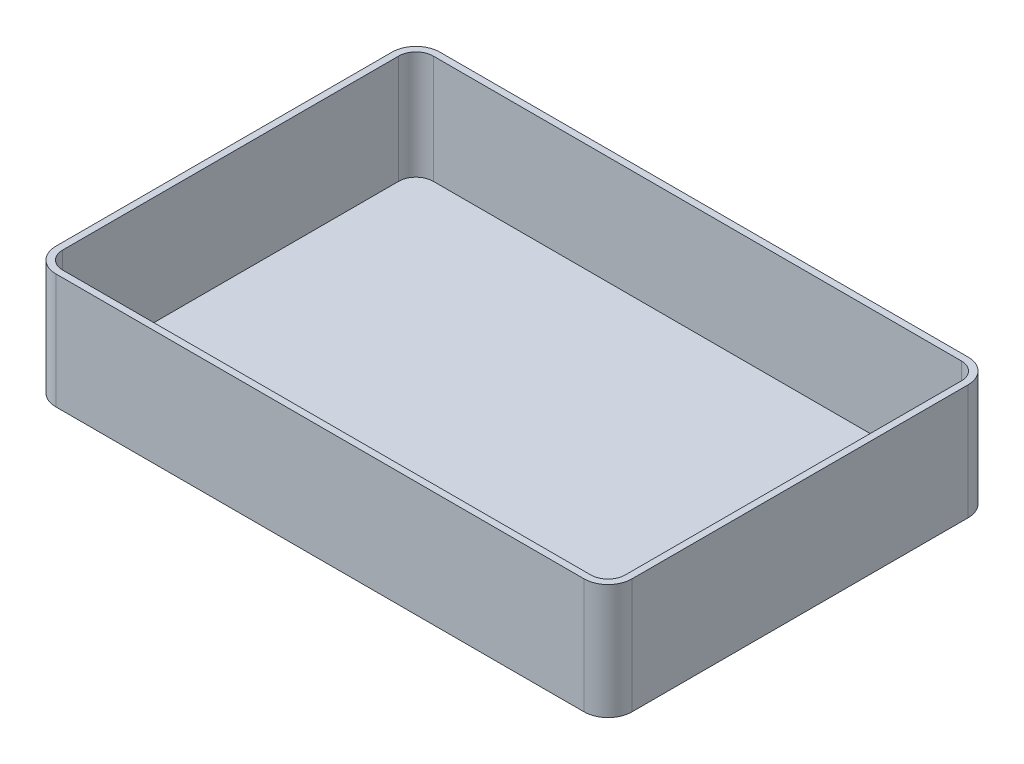
from build123d import *

# Parameters (mm, degrees)
BOSS_EXTRUDE1_DEPTH = 120
SHELL1_T            = -7


with BuildPart() as part:
    # Sketch1 → Boss-Extrude1 (new body)
    with BuildSketch(Plane(origin=(0, 0, 0), x_dir=(1, 0, 0), z_dir=(0, 1, 0))):
        with BuildLine():
            Line((-275, -200), (275, -200))
            ThreePointArc((275, -200), (292.67766953, -192.67766953), (300, -175))
            Line((300, -175), (300, 175))
            ThreePointArc((300, 175), (292.67766953, 192.67766953), (275, 200))
            Line((275, 200), (-275, 200))
            ThreePointArc((-275, 200), (-292.67766953, 192.67766953), (-300, 175))
            Line((-300, 175), (-300, -175))
            ThreePointArc((-300, -175), (-292.67766953, -192.67766953), (-275, -200))
        make_face()
    extrude(amount=BOSS_EXTRUDE1_DEPTH)

    # Shell1
    shell1_openings = [part.faces().sort_by_distance(p)[0] for p in [
        (0, 120, 0),
    ]]
    offset(amount=SHELL1_T, openings=shell1_openings, kind=Kind.INTERSECTION)


solid = part.part
